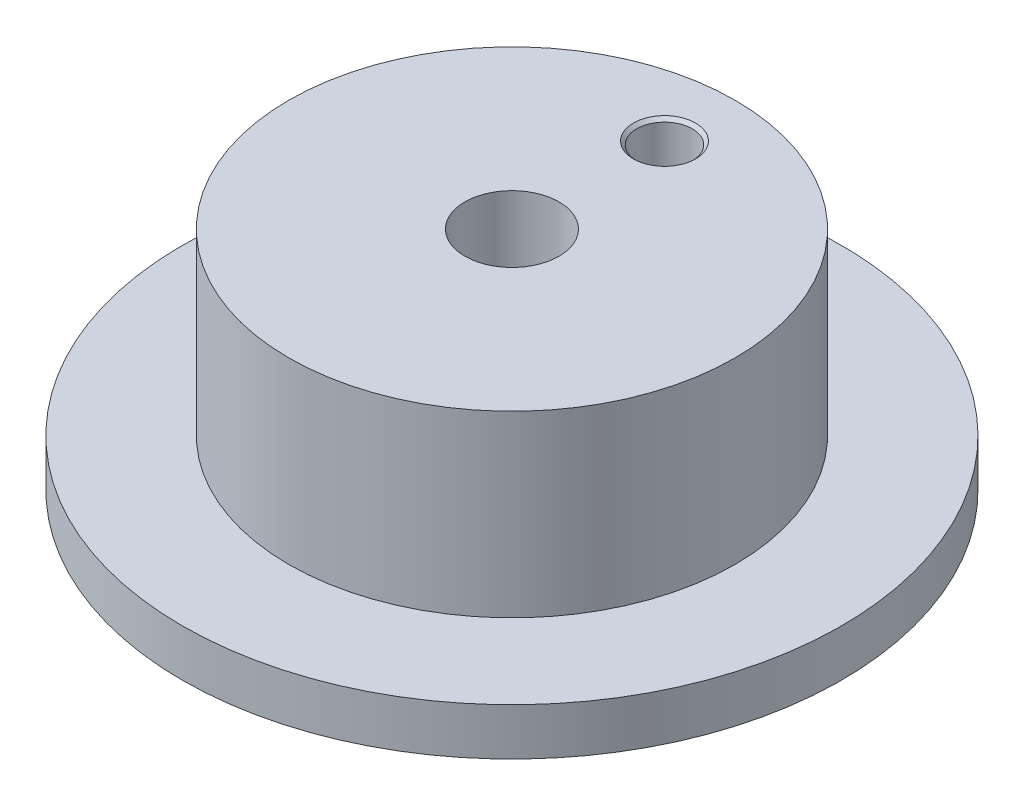
from build123d import *

# Parameters (mm, degrees)
G1_4_TAPPED_HOLE1_D           = 11.8
G1_4_TAPPED_HOLE1_CSINK_D     = 13.207
G1_4_TAPPED_HOLE1_CSINK_ANGLE = 90


with BuildPart() as part:
    # Sketch1 → Revolve1 (revolve)
    with BuildSketch(Plane.XY, mode=Mode.PRIVATE) as revolve1_sk:
        with BuildLine():
            Line((-10, 0), (-10, -48))
            Line((-10, -48), (-12.5, -48))
            Line((-12.5, -48), (-12.5, -46.2))
            ThreePointArc((-12.5, -46.2), (-12.558578644, -46.058578644), (-12.7, -46))
            Line((-12.7, -46), (-15.541966742, -46))
            ThreePointArc((-15.541966742, -46), (-15.689068469, -46.060931531), (-15.75, -46.208033258))
            Line((-15.75, -46.208033258), (-15.75, -48))
            Line((-15.75, -48), (-18.5, -48))
            Line((-18.5, -48), (-18.5, -46.208033258))
            ThreePointArc((-18.5, -46.208033258), (-18.560931531, -46.060931531), (-18.708033258, -46))
            Line((-18.708033258, -46), (-21.541966742, -46))
            ThreePointArc((-21.541966742, -46), (-21.689068469, -46.060931531), (-21.75, -46.208033258))
            Line((-21.75, -46.208033258), (-21.75, -48))
            Line((-21.75, -48), (-24, -48))
            Line((-24, -48), (-24, -20))
            Line((-24, -20), (-39.4, -20))
            Line((-39.4, -20), (-39.4, -48))
            Line((-39.4, -48), (-42, -48))
            Line((-42, -48), (-42, -46.208033258))
            ThreePointArc((-42, -46.208033258), (-42.060931531, -46.060931531), (-42.208033258, -46))
            Line((-42.208033258, -46), (-45.041966742, -46))
            ThreePointArc((-45.041966742, -46), (-45.189068469, -46.060931531), (-45.25, -46.208033258))
            Line((-45.25, -46.208033258), (-45.25, -48))
            Line((-45.25, -48), (-47.75, -48))
            Line((-47.75, -48), (-47.75, -46.208033258))
            ThreePointArc((-47.75, -46.208033258), (-47.810931531, -46.060931531), (-47.958033258, -46))
            Line((-47.958033258, -46), (-50.791966742, -46))
            ThreePointArc((-50.791966742, -46), (-50.939068469, -46.060931531), (-51, -46.208033258))
            Line((-51, -46.208033258), (-51, -48))
            Line((-51, -48), (-70, -48))
            Line((-70, -48), (-70, -38))
            Line((-70, -38), (-47.4, -38))
            Line((-47.4, -38), (-47.4, 0))
            Line((-47.4, 0), (-10, 0))
        make_face()
    revolve(revolve1_sk.sketch.rotate(Axis((0, 0, 0), (0, -1, 0)), 270), axis=Axis((0, 0, 0), (0, -1, 0)))

    # G1/4 Tapped Hole1 (through all)
    with Locations(Plane(origin=(0, 0, 0), x_dir=(1, 0, 0), z_dir=(0, 1, 0))):
        with Locations((0, 32.4)):
            CounterSinkHole(G1_4_TAPPED_HOLE1_D / 2, G1_4_TAPPED_HOLE1_CSINK_D / 2, counter_sink_angle=G1_4_TAPPED_HOLE1_CSINK_ANGLE)


solid = part.part
